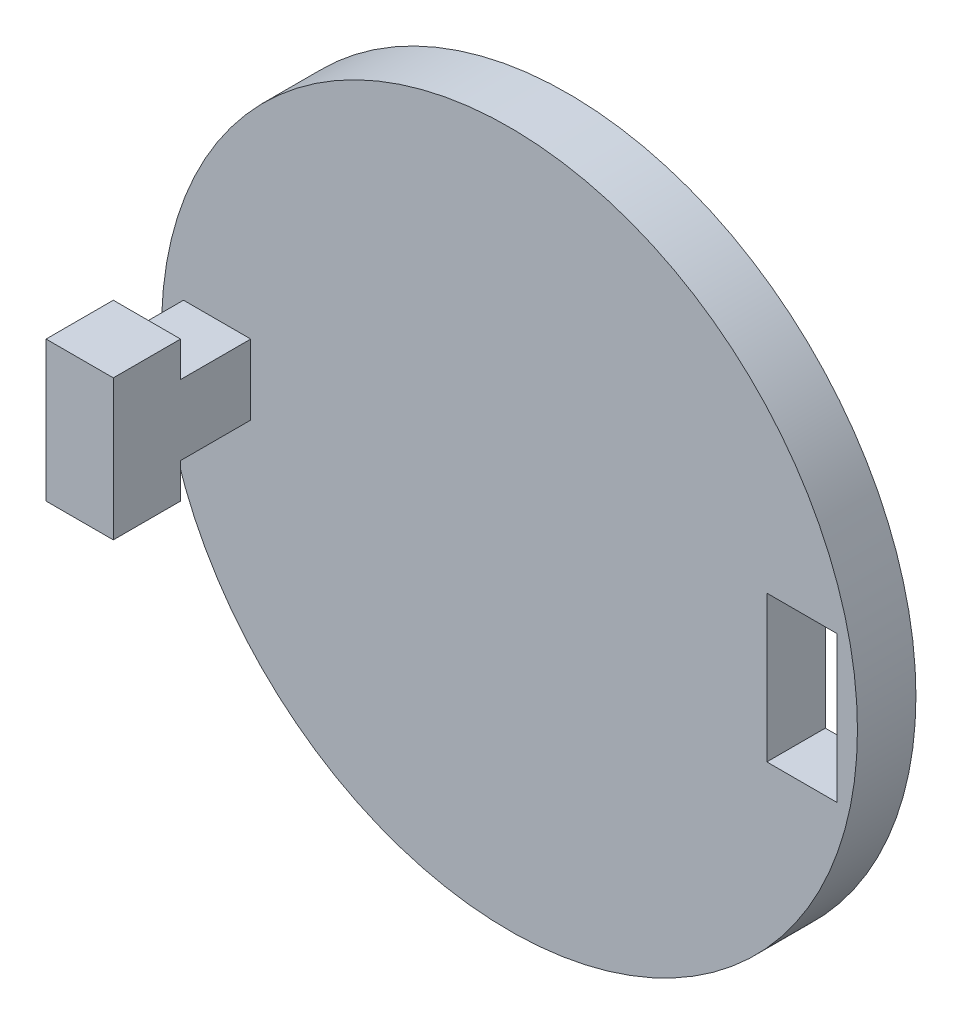
from build123d import *

# Parameters (mm, degrees)
SKETCH1_R           = 11.9
SKETCH1_W           = 2.4
SKETCH1_H           = 5
BOSS_EXTRUDE2_DEPTH = 2
SKETCH2_W           = 2.3
SKETCH2_H           = 2.4
BOSS_EXTRUDE3_DEPTH = 4.7
SKETCH4_W           = 2.3
SKETCH4_H           = 2.3
BOSS_EXTRUDE5_DEPTH = 1.2
SKETCH5_W           = 2.3
SKETCH5_H           = 2.3
BOSS_EXTRUDE6_DEPTH = 1.2


with BuildPart() as part:
    # Sketch1 → Boss-Extrude2 (new body)
    with BuildSketch(Plane.XY):
        Circle(SKETCH1_R)
        with Locations((10, 0)):
            Rectangle(SKETCH1_W, SKETCH1_H, mode=Mode.SUBTRACT)
    extrude(amount=BOSS_EXTRUDE2_DEPTH)

    # Sketch2 → Boss-Extrude3 (add)
    with BuildSketch(Plane.XY.offset(2)):
        with Locations((-10, 0)):
            Rectangle(SKETCH2_W, SKETCH2_H)
    extrude(amount=BOSS_EXTRUDE3_DEPTH)

    # Sketch4 → Boss-Extrude5 (add)
    with BuildSketch(Plane(origin=(0, 1.2, 0), x_dir=(1, 0, 0), z_dir=(0, 1, 0))):
        with Locations((-10, -5.55)):
            Rectangle(SKETCH4_W, SKETCH4_H)
    extrude(amount=BOSS_EXTRUDE5_DEPTH)

    # Sketch5 → Boss-Extrude6 (add)
    with BuildSketch(Plane.XZ.offset(1.2)):
        with Locations((-10, 5.55)):
            Rectangle(SKETCH5_W, SKETCH5_H)
    extrude(amount=BOSS_EXTRUDE6_DEPTH)


solid = part.part
